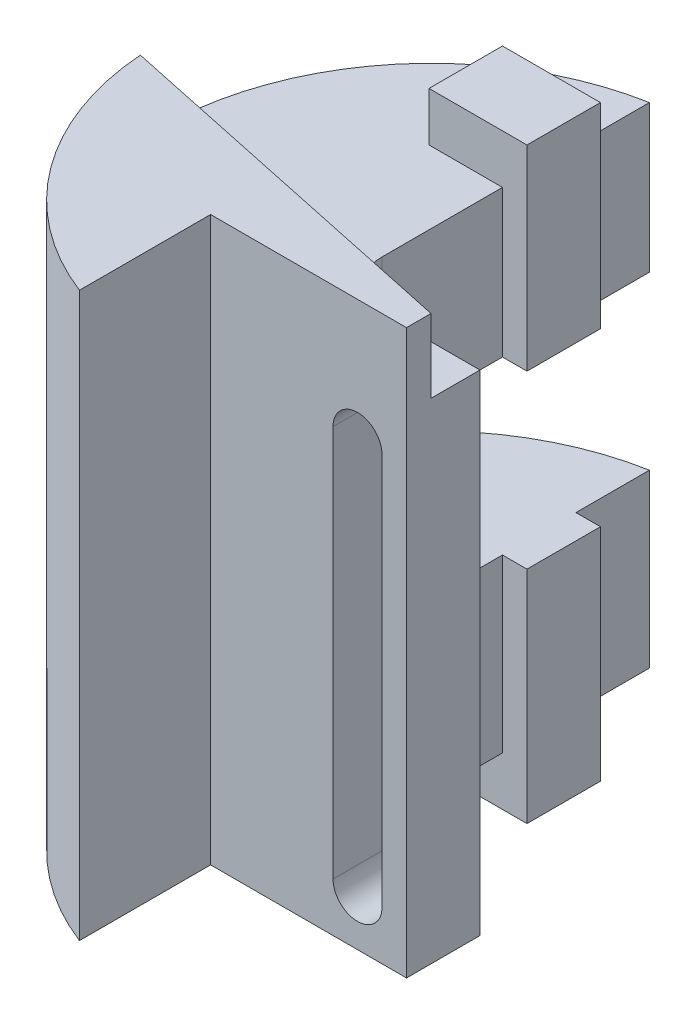
from build123d import *

# Parameters (mm, degrees)
BOSS_EXTRUDE1_DEPTH = 100
CUT_EXTRUDE1_DEPTH  = 100
BOSS_EXTRUDE2_DEPTH = 15
SKETCH4_W           = 40
SKETCH4_H           = 35
CUT_EXTRUDE2_DEPTH  = 137.950721064
SKETCH5_W           = 20
SKETCH5_H           = 15
BOSS_EXTRUDE3_DEPTH = 10
SKETCH6_W           = 20
SKETCH6_H           = 15
BOSS_EXTRUDE4_DEPTH = 10


with BuildPart() as part:
    # Sketch1 → Boss-Extrude1 (new body)
    with BuildSketch(Plane(origin=(0, 0, 0), x_dir=(1, 0, 0), z_dir=(0, 1, 0))):
        with BuildLine():
            Line((-10, 54.591666031), (-10, 39.591666031))
            Line((-10, 39.591666031), (-5, 39.591666031))
            Line((-5, 39.591666031), (-5, 24.591666031))
            Line((-5, 24.591666031), (-10, 24.591666031))
            Line((-10, 24.591666031), (-10, 0))
            ThreePointArc((-10, 0), (-7.071067812, -7.071067812), (0, -10))
            Line((0, -10), (20, -10))
            Line((20, -10), (20, -25))
            Line((20, -25), (-20, -25))
            Line((-20, -25), (-20, -51.771130952))
            ThreePointArc((-20, -51.771130952), (-55.256322222, 5.195079839), (-10, 54.591666031))
        make_face()
    extrude(amount=BOSS_EXTRUDE1_DEPTH)

    # Sketch2 → Cut-Extrude1 (cut)
    with BuildSketch(Plane(origin=(0, 0, 10), x_dir=(-1, 0, 0), z_dir=(0, 0, -1))):
        with BuildLine():
            Line((-5, 90.003555636), (-5, 10.003555636))
            ThreePointArc((-5, 10.003555636), (-10, 5.003555636), (-15, 10.003555636))
            Line((-15, 10.003555636), (-15, 90.003555636))
            ThreePointArc((-15, 90.003555636), (-10, 95.003555636), (-5, 90.003555636))
        make_face()
    extrude(amount=-CUT_EXTRUDE1_DEPTH, mode=Mode.SUBTRACT)

    # Sketch3 → Boss-Extrude2 (add)
    with BuildSketch(Plane(origin=(0, 100, 0), x_dir=(1, 0, 0), z_dir=(0, 1, 0))):
        with BuildLine():
            Line((20, -25), (20, -20))
            Line((20, -20), (-55.356937984, -3.982388364))
            ThreePointArc((-55.356937984, -3.982388364), (-44.616230288, -33.009725763), (-20, -51.771130952))
            Line((-20, -51.771130952), (-20, -25))
            Line((-20, -25), (20, -25))
        make_face()
    extrude(amount=BOSS_EXTRUDE2_DEPTH)

    # Sketch4 → Cut-Extrude2 (cut, through all)
    with BuildSketch(Plane(origin=(-5, 0, 0), x_dir=(0, 0, -1), z_dir=(1, 0, 0))):
        with Locations((34.591666031, 52.5)):
            Rectangle(SKETCH4_W, SKETCH4_H)
    extrude(amount=-CUT_EXTRUDE2_DEPTH, mode=Mode.SUBTRACT)

    # Sketch5 → Boss-Extrude3 (add)
    with BuildSketch(Plane(origin=(0, 100, 0), x_dir=(1, 0, 0), z_dir=(0, 1, 0))):
        with Locations((-15, 32.091666031)):
            Rectangle(SKETCH5_W, SKETCH5_H)
    extrude(amount=BOSS_EXTRUDE3_DEPTH)

    # Sketch6 → Boss-Extrude4 (add)
    with BuildSketch(Plane.XZ):
        with Locations((-15, -32.091666031)):
            Rectangle(SKETCH6_W, SKETCH6_H)
    extrude(amount=BOSS_EXTRUDE4_DEPTH)


solid = part.part
